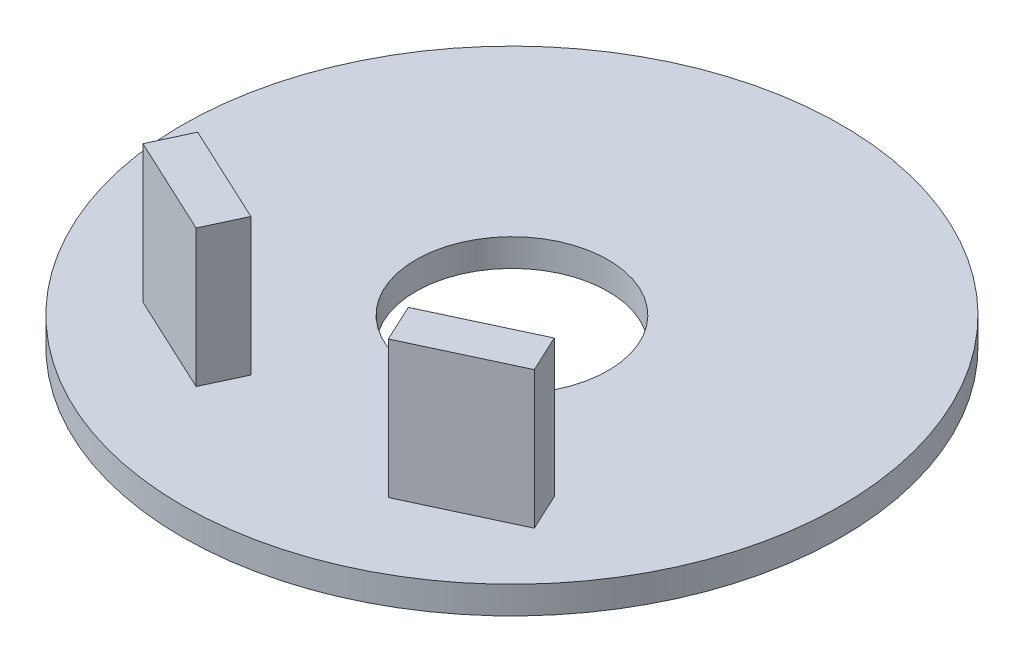
from build123d import *

# Parameters (mm, degrees)
SKETCH1_R           = 12
SKETCH1_R_2         = 3.5
BOSS_EXTRUDE1_DEPTH = 0.5
BOSS_EXTRUDE3_DEPTH = 5


with BuildPart() as part:
    # Sketch1 → Boss-Extrude1 (new, symmetric)
    with BuildSketch(Plane(origin=(0, 0, 0), x_dir=(1, 0, 0), z_dir=(0, 1, 0))):
        with Locations(Location((0, 0, 0), (0, 0, 270))):
            Circle(SKETCH1_R)
        with Locations(Location((0, 0, 0), (0, 0, 270))):
            Circle(SKETCH1_R_2, mode=Mode.SUBTRACT)
    extrude(amount=BOSS_EXTRUDE1_DEPTH, both=True)

    # Sketch5 → Boss-Extrude3 (add)
    with BuildSketch(Plane(origin=(0, 0.5, 0), x_dir=(1, 0, 0), z_dir=(0, 1, 0))):
        Polygon((-6.491303756, -4.950065272), (-2.866072607, -6.640538319), (-3.5, -8), (-7.125231148, -6.309526953), align=None)
        Polygon((7.125231148, -6.309526953), (6.491303756, -4.950065272), (2.866072607, -6.640538319), (3.5, -8), align=None)
    extrude(amount=BOSS_EXTRUDE3_DEPTH)


solid = part.part
